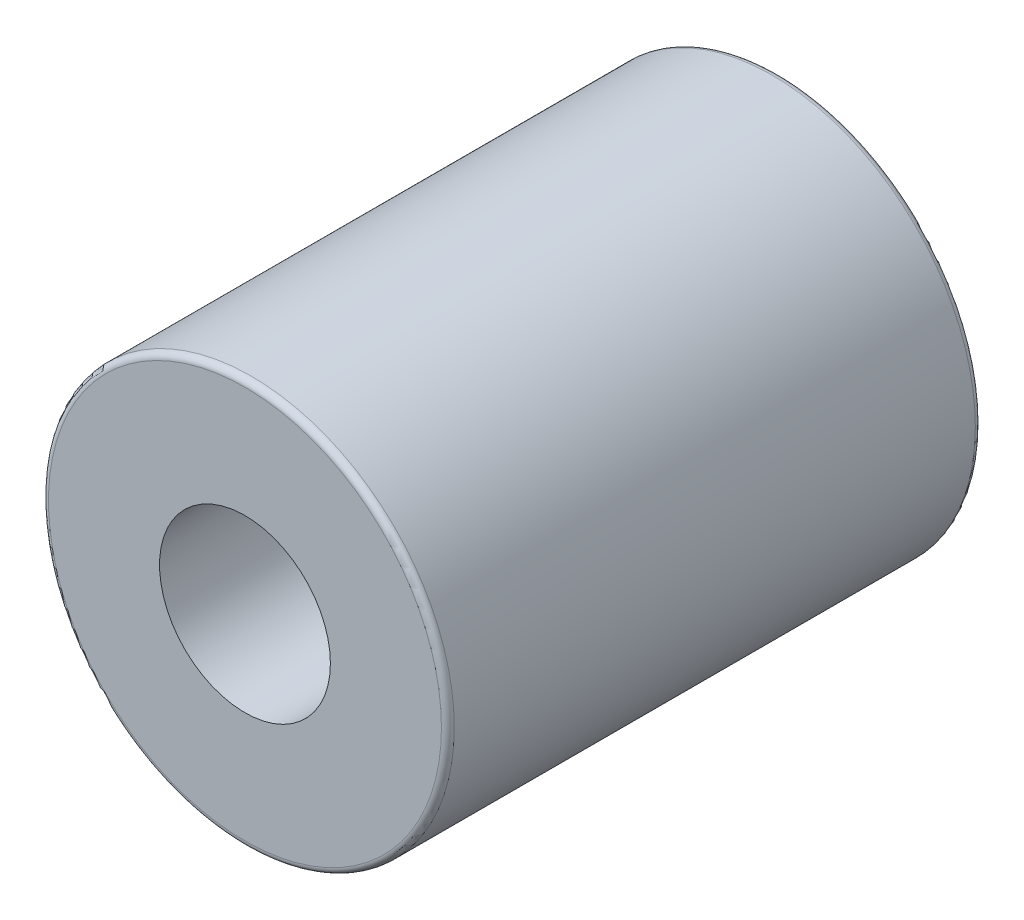
from build123d import *

# Parameters (mm, degrees)
SKETCH_1_R          = 9.5
SKETCH_1_R_2        = 2.5
EXTRUDE_1_DEPTH     = 25
SKETCH_2_R          = 4
CUT_EXTRUDE_1_DEPTH = 12.5
FILLET_1_R          = 0.3


with BuildPart() as part:
    # 草图1 → 凸台-拉伸1 (new body)
    with BuildSketch(Plane.XY):
        Circle(SKETCH_1_R)
        Circle(SKETCH_1_R_2, mode=Mode.SUBTRACT)
    extrude(amount=EXTRUDE_1_DEPTH)

    # 草图2 → 切除-拉伸1 (cut)
    with BuildSketch(Plane.XY.offset(25)):
        Circle(SKETCH_2_R)
    extrude(amount=-CUT_EXTRUDE_1_DEPTH, mode=Mode.SUBTRACT)

    # 圆角1
    fillet_1_edges = [part.edges().sort_by_distance(p)[0] for p in [
        (-9.5, 0, 0),
        (-9.5, 0, 25),
    ]]
    fillet(fillet_1_edges, radius=FILLET_1_R)


solid = part.part
